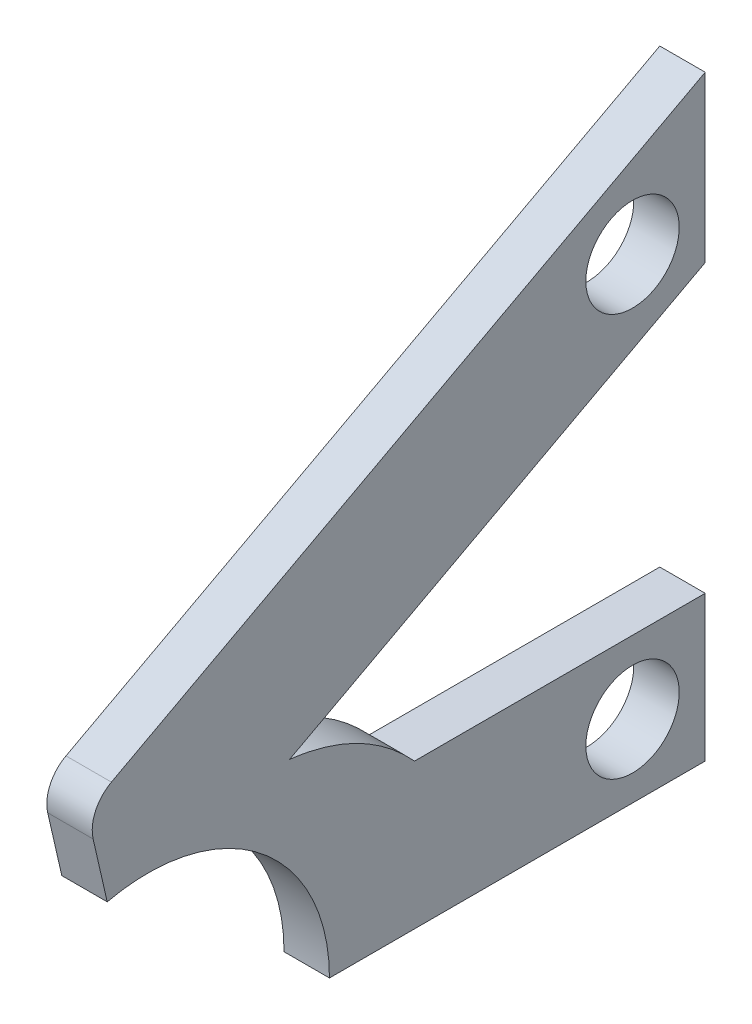
from build123d import *

# Parameters (mm, degrees)
BOSS_EXTRUDE1_DEPTH = 3.175
SKETCH7_R           = 3.2639
CUT_EXTRUDE3_DEPTH  = 678.24348403


with BuildPart() as part:
    # Sketch2 → Boss-Extrude1 (new body)
    with BuildSketch(Plane(origin=(-112.555, 0, -573.58969557), x_dir=(0, 0.6231241879767124, 0.7821229100073485), z_dir=(-1, 0, 0))):
        with BuildLine():
            Line((843.785187932, 138.582376841), (864.330586832, 122.213677187))
            ThreePointArc((864.330586832, 122.213677187), (874.263547789, 127), (884.196508746, 122.213677187))
            Line((884.196508746, 122.213677187), (887.645495372, 124.961515108))
            ThreePointArc((887.645495372, 124.961515108), (888.526447304, 126.330171585), (888.395706135, 127.952578317))
            Line((888.395706135, 127.952578317), (869.77401473, 171.202610873))
            Line((869.77401473, 171.202610873), (862.593047153, 162.189320479))
            Line((862.593047153, 162.189320479), (875.624929298, 131.921966414))
            add(Edge.make_bspline(
                [(866.008867214, 133.866862107), (871.18323177, 134.685144315), (875.624929298, 131.921966414)],
                knots=[0, 0, 0, 1, 1, 1], degree=2))
            Line((866.008867214, 133.866862107), (850.116129682, 146.528745607))
            Line((850.116129682, 146.528745607), (843.785187932, 138.582376841))
        make_face()
    extrude(amount=BOSS_EXTRUDE1_DEPTH)

    # Sketch7 → Cut-Extrude3 (cut, through all)
    with BuildSketch(Plane.ZY.offset(115.73)):
        with Locations((5.08, 639.251411908)):
            Circle(SKETCH7_R)
        with Locations((5.08, 667.397263635)):
            Circle(SKETCH7_R)
    extrude(amount=-CUT_EXTRUDE3_DEPTH, mode=Mode.SUBTRACT)


solid = part.part
